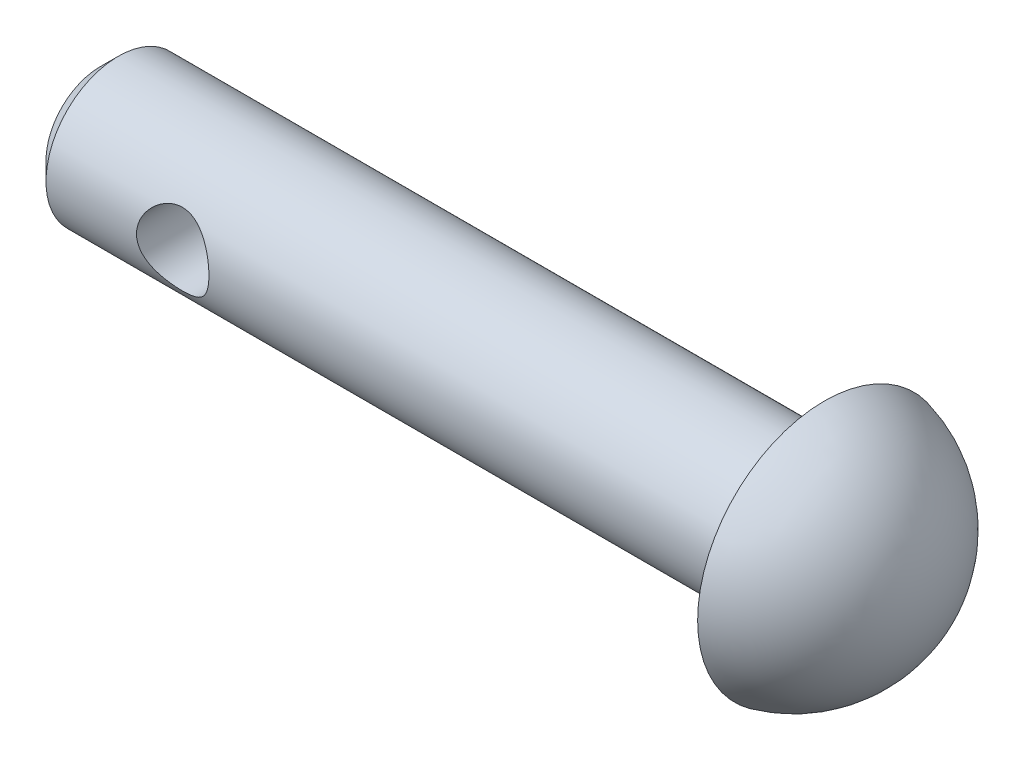
from build123d import *

# Parameters (mm, degrees)
SKETCH1_R               = 2
BOSS_EXTRUDE1_DEPTH     = 10
CHAMFER1_SIZE           = 0.5
CUT_EXTRUDE1_DEPTH      = 14.683964068
CUT_EXTRUDE1_DEPTH_BACK = 14.683964068
SKETCH3_R               = 1


with BuildPart() as part:
    # Sketch1 → Boss-Extrude1 (new, symmetric)
    with BuildSketch(Plane(origin=(0, 0, 0), x_dir=(0, 0, -1), z_dir=(1, 0, 0))):
        Circle(SKETCH1_R)
    extrude(amount=BOSS_EXTRUDE1_DEPTH, both=True)

    # Chamfer1
    chamfer1_edges = [part.edges().sort_by_distance(p)[0] for p in [
        (-10, 0, 2),
    ]]
    chamfer(chamfer1_edges, length=CHAMFER1_SIZE)

    # Sketch2 → Revolve1 (revolve)
    with BuildSketch(Plane.XY):
        with BuildLine():
            Line((10, 0), (10, 3.5))
            ThreePointArc((10, 3.5), (11.985229955, 2.227844932), (12.757385023, 0))
            Line((12.757385023, 0), (10, 0))
        make_face()
    revolve(axis=Axis((9.157385023, 0, 0), (1, 0, 0)))

    # Sketch3 → Cut-Extrude1 (cut, two sides: drawn at the far end of the back side and taken through both)
    with BuildSketch(Plane.XY.offset(-CUT_EXTRUDE1_DEPTH_BACK)):
        with Locations((-6, 0)):
            Circle(SKETCH3_R)
    extrude(amount=CUT_EXTRUDE1_DEPTH + CUT_EXTRUDE1_DEPTH_BACK, mode=Mode.SUBTRACT)


solid = part.part
